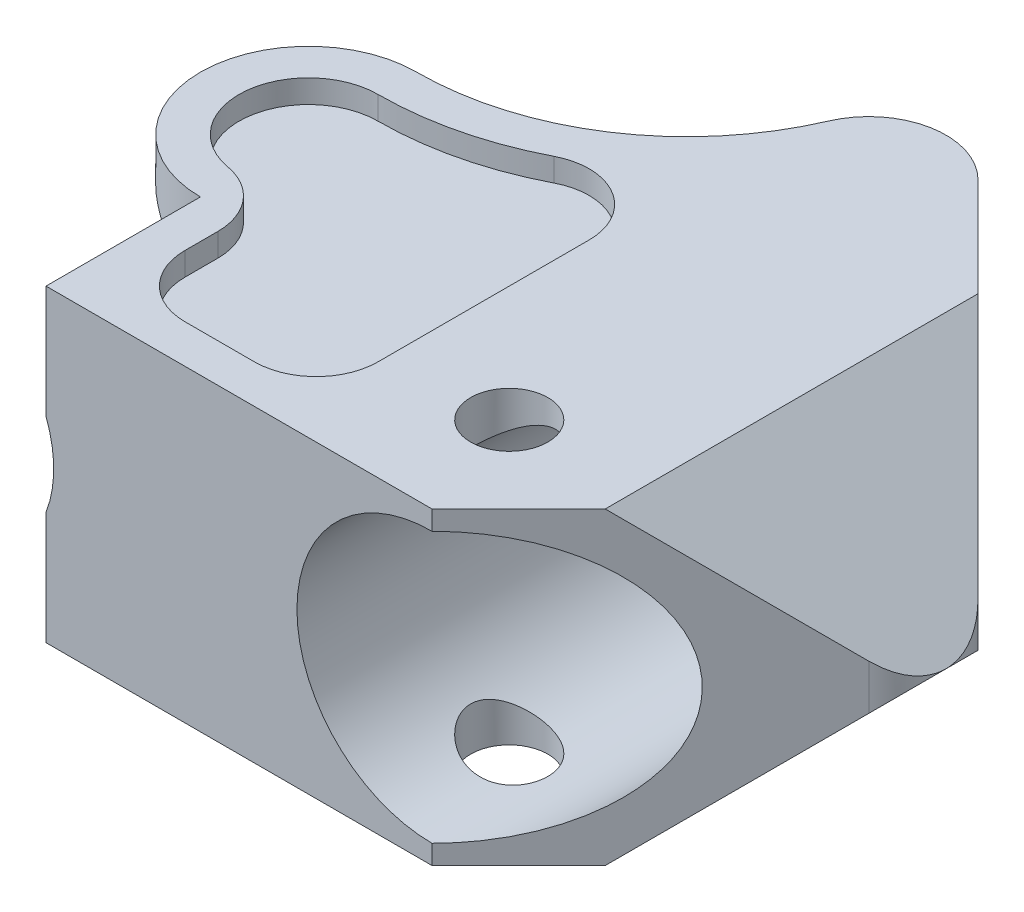
from build123d import *

# Parameters (mm, degrees)
BOSS_EXTRUDE1_DEPTH     = 40
CUT_EXTRUDE1_DEPTH      = 3
CUT_EXTRUDE2_DEPTH      = 118.705944338
CUT_EXTRUDE2_DEPTH_BACK = 118.705944338
SKETCH3_R               = 17.5
SKETCH4_R               = 5
CUT_EXTRUDE4_DEPTH      = 118.705944436
CUT_EXTRUDE6_DEPTH      = 118.705944436
CUT_EXTRUDE6_DEPTH_BACK = 118.705944436


with BuildPart() as part:
    # Sketch1 → Boss-Extrude1 (new body)
    with BuildSketch(Plane(origin=(0, 0, 0), x_dir=(1, 0, 0), z_dir=(0, 1, 0))):
        with BuildLine():
            Line((0, 0), (50, 0))
            Line((50, 0), (78.284271247, 28.284271247))
            ThreePointArc((78.284271247, 28.284271247), (81.213203436, 35.355339059), (78.284271247, 42.426406871))
            Line((78.284271247, 42.426406871), (48.412587767, 72.298090352))
            ThreePointArc((48.412587767, 72.298090352), (39.455979063, 75.047650602), (32.154515521, 69.176573087))
            ThreePointArc((32.154515521, 69.176573087), (19.250715026, 53.76970799), (0, 48))
            ThreePointArc((0, 48), (-14, 34), (0, 20))
            Line((0, 20), (0, 0))
        make_face()
    extrude(amount=BOSS_EXTRUDE1_DEPTH)

    # Sketch2 → Cut-Extrude1 (cut)
    with BuildSketch(Plane(origin=(0, 40, 0), x_dir=(1, 0, 0), z_dir=(0, 1, 0))):
        with BuildLine():
            Line((30, 13), (30, 40.338541985))
            ThreePointArc((30, 40.338541985), (26.163331999, 47.169842495), (18.333333333, 47.448784987))
            ThreePointArc((18.333333333, 47.448784987), (9.432693133, 44.128103979), (0, 43))
            ThreePointArc((0, 43), (-8.964618759, 34.797251843), (-1.588235294, 25.141246778))
            ThreePointArc((-1.588235294, 25.141246778), (3.135719911, 22.400311053), (5, 17.266799469))
            Line((5, 17.266799469), (5, 13))
            ThreePointArc((5, 13), (7.343145751, 7.343145751), (13, 5))
            Line((13, 5), (22, 5))
            ThreePointArc((22, 5), (27.656854249, 7.343145751), (30, 13))
        make_face()
    extrude(amount=-CUT_EXTRUDE1_DEPTH, mode=Mode.SUBTRACT)

    # Sketch3 → Cut-Extrude2 (cut, two sides: drawn at the far end of the back side and taken through both)
    with BuildSketch(Plane.XY.offset(-CUT_EXTRUDE2_DEPTH_BACK)):
        with Locations(Location((50, 20, 0), (0, 0, 90))):
            Circle(SKETCH3_R)
        with BuildLine():
            Line((-14, 35), (-14, 5))
            ThreePointArc((-14, 5), (1, 20), (-14, 35))
        make_face()
    extrude(amount=CUT_EXTRUDE2_DEPTH + CUT_EXTRUDE2_DEPTH_BACK, mode=Mode.SUBTRACT)

    # Sketch4 → Cut-Extrude4 (cut, through all)
    with BuildSketch(Plane(origin=(0, 40, 0), x_dir=(1, 0, 0), z_dir=(0, 1, 0))):
        with Locations(Location((45, 15, 0), (0, 0, 270))):
            Circle(SKETCH4_R)
    extrude(amount=-CUT_EXTRUDE4_DEPTH, mode=Mode.SUBTRACT)

    # Sketch7 → Cut-Extrude6 (cut, two sides: drawn at the far end of the back side and taken through both)
    with BuildSketch(Plane.XY.offset(-CUT_EXTRUDE6_DEPTH_BACK)):
        Polygon((-66.33214374, 167.545347175), (61.213203436, 40), (81.213203436, 20), (61.213203436, 0), (-66.33214374, -127.545347175), (294.420575846, -127.545347175), (294.420575846, 167.545347175), align=None)
    extrude(amount=CUT_EXTRUDE6_DEPTH + CUT_EXTRUDE6_DEPTH_BACK, mode=Mode.SUBTRACT)


solid = part.part
